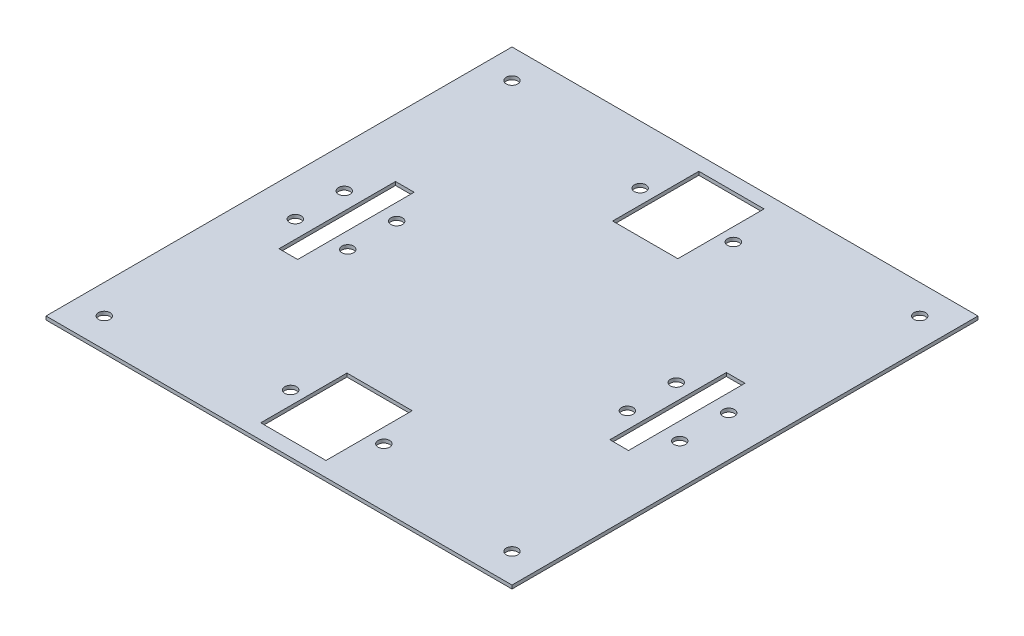
from build123d import *

# Parameters (mm, degrees)
SKETCH1_W           = 400
SKETCH1_H           = 400
BOSS_EXTRUDE1_DEPTH = 3
SKETCH3_W           = 16
SKETCH3_H           = 100
CUT_EXTRUDE1_DEPTH  = 3
SKETCH4_W           = 56
SKETCH4_H           = 74
CUT_EXTRUDE2_DEPTH  = 3
SKETCH5_R           = 5
CUT_EXTRUDE3_DEPTH  = 3


with BuildPart() as part:
    # Sketch1 → Boss-Extrude1 (new body)
    with BuildSketch(Plane(origin=(0, 0, 0), x_dir=(1, 0, 0), z_dir=(0, 1, 0))):
        Rectangle(SKETCH1_W, SKETCH1_H)
    extrude(amount=BOSS_EXTRUDE1_DEPTH)

    # Sketch3 → Cut-Extrude1 (cut)
    with BuildSketch(Plane(origin=(0, 3, 0), x_dir=(1, 0, 0), z_dir=(0, 1, 0))):
        with Locations((-141.990723633, 0.005834667)):
            Rectangle(SKETCH3_W, SKETCH3_H)
        with Locations((141.996469981, 0.005657447)):
            Rectangle(SKETCH3_W, SKETCH3_H)
    extrude(amount=-CUT_EXTRUDE1_DEPTH, mode=Mode.SUBTRACT)

    # Sketch4 → Cut-Extrude2 (cut)
    with BuildSketch(Plane(origin=(0, 3, 0), x_dir=(1, 0, 0), z_dir=(0, 1, 0))):
        with Locations((0.607935106, 150.770035388)):
            Rectangle(SKETCH4_W, SKETCH4_H)
        with Locations((-0.434902884, -150.241190723)):
            Rectangle(SKETCH4_W, SKETCH4_H)
    extrude(amount=-CUT_EXTRUDE2_DEPTH, mode=Mode.SUBTRACT)

    # Sketch5 → Cut-Extrude3 (cut)
    with BuildSketch(Plane(origin=(0, 3, 0), x_dir=(1, 0, 0), z_dir=(0, 1, 0))):
        with Locations(Location((-165, 21, 0), (0, 0, 270))):
            Circle(SKETCH5_R)
        with Locations(Location((-165, -21, 0), (0, 0, 270))):
            Circle(SKETCH5_R)
        with Locations(Location((-120, 21, 0), (0, 0, 270))):
            Circle(SKETCH5_R)
        with Locations(Location((-120, -21, 0), (0, 0, 270))):
            Circle(SKETCH5_R)
        with Locations(Location((165, 21, 0), (0, 0, 270))):
            Circle(SKETCH5_R)
        with Locations(Location((165, -21, 0), (0, 0, 270))):
            Circle(SKETCH5_R)
        with Locations(Location((120, 21, 0), (0, 0, 270))):
            Circle(SKETCH5_R)
        with Locations(Location((120, -21, 0), (0, 0, 270))):
            Circle(SKETCH5_R)
        with Locations(Location((-40, -150, 0), (0, 0, 270))):
            Circle(SKETCH5_R)
        with Locations(Location((40, -150, 0), (0, 0, 270))):
            Circle(SKETCH5_R)
        with Locations(Location((-40, 150, 0), (0, 0, 270))):
            Circle(SKETCH5_R)
        with Locations(Location((40, 150, 0), (0, 0, 270))):
            Circle(SKETCH5_R)
        with Locations(Location((-175, 175, 0), (0, 0, 270))):
            Circle(SKETCH5_R)
        with Locations(Location((175, 175, 0), (0, 0, 270))):
            Circle(SKETCH5_R)
        with Locations(Location((175, -175, 0), (0, 0, 270))):
            Circle(SKETCH5_R)
        with Locations(Location((-175, -175, 0), (0, 0, 270))):
            Circle(SKETCH5_R)
    extrude(amount=-CUT_EXTRUDE3_DEPTH, mode=Mode.SUBTRACT)


solid = part.part
